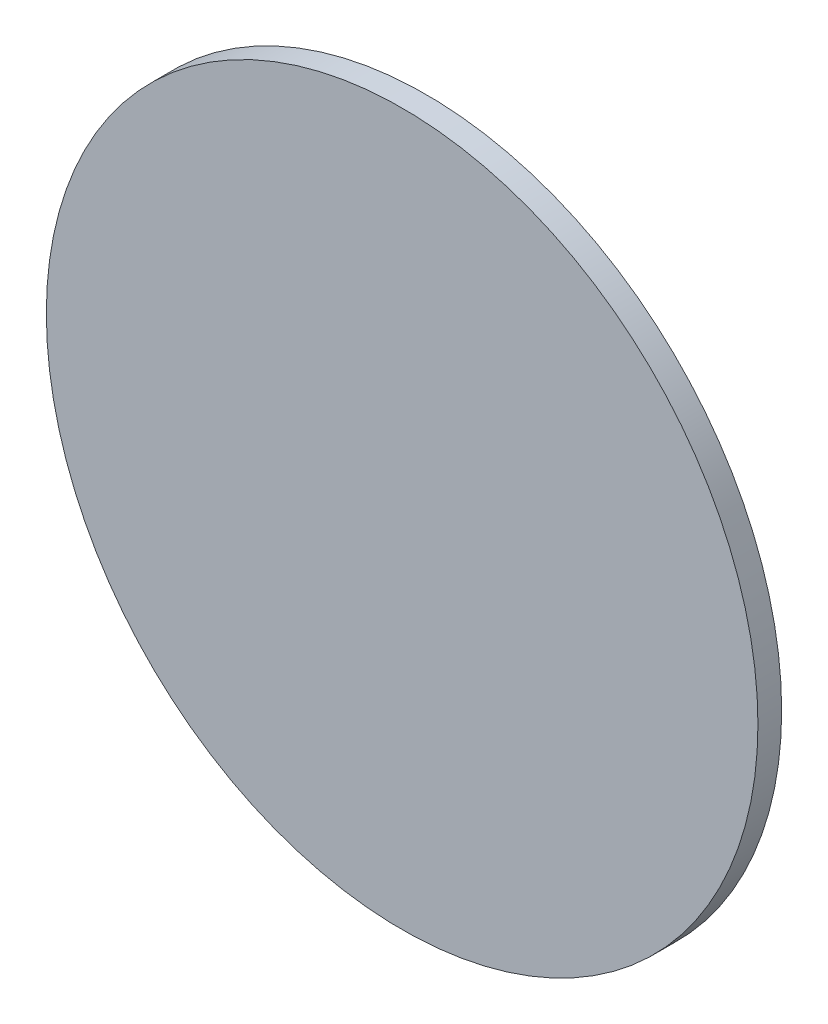
from build123d import *

# Parameters (mm, degrees)
SKETCH1_R           = 60
BOSS_EXTRUDE1_DEPTH = 4
SKETCH2_R           = 2.7
CUT_EXTRUDE1_DEPTH  = 2.5


with BuildPart() as part:
    # Sketch1 → Boss-Extrude1 (new body)
    with BuildSketch(Plane.XY):
        Circle(SKETCH1_R)
    extrude(amount=BOSS_EXTRUDE1_DEPTH)

    # Sketch2 → Cut-Extrude1 (cut)
    with BuildSketch(Plane(origin=(0, 0, 0.6), x_dir=(-1, 0, 0), z_dir=(0, 0, -1))):
        with Locations((0, 20)):
            Circle(SKETCH2_R)
        with Locations((20, 0)):
            Circle(SKETCH2_R)
        with Locations((0, -20)):
            Circle(SKETCH2_R)
        with Locations((-20, 0)):
            Circle(SKETCH2_R)
    extrude(amount=-CUT_EXTRUDE1_DEPTH, mode=Mode.SUBTRACT)


solid = part.part
